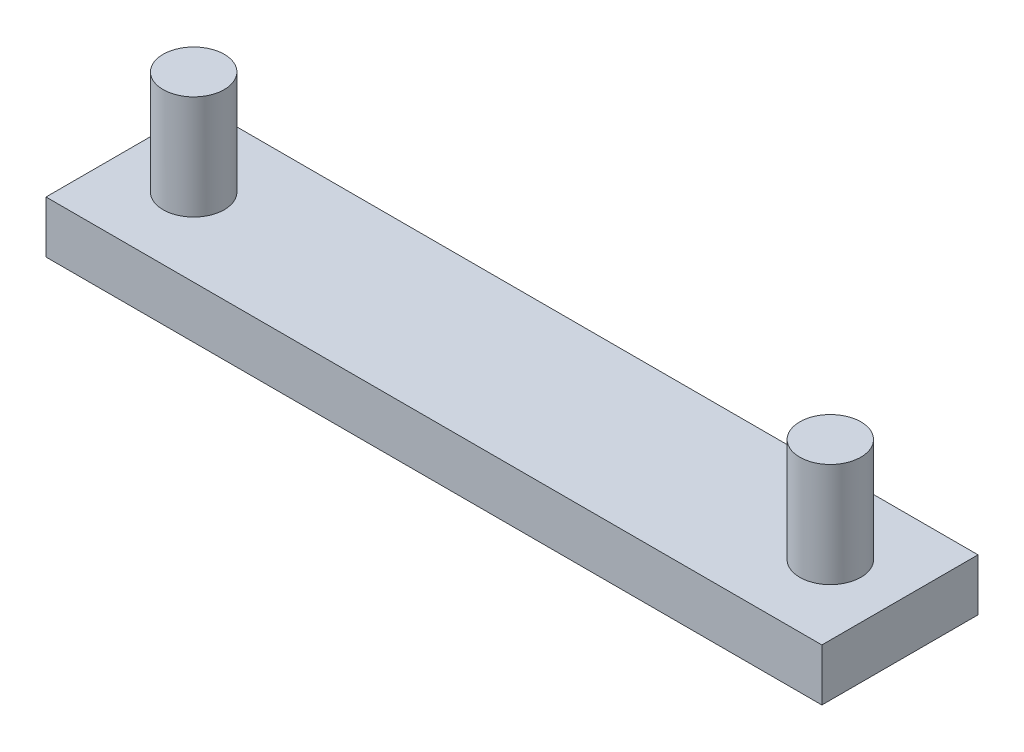
from build123d import *

# Parameters (mm, degrees)
BOSS_EXTRUDE1_DEPTH = 50.8
SKETCH2_R           = 29.86
BOSS_EXTRUDE2_DEPTH = 152.4


with BuildPart() as part:
    # Sketch1 → Boss-Extrude1 (new body)
    with BuildSketch(Plane(origin=(0, 0, 0), x_dir=(1, 0, 0), z_dir=(0, 1, 0))):
        with BuildLine():
            Line((67.96, 0), (29.86, 0))
            ThreePointArc((29.86, 0), (0, -29.86), (-29.86, 0))
            Line((-29.86, 0), (-591.61, 0))
            ThreePointArc((-591.61, 0), (-621.47, -29.86), (-651.33, 0))
            Line((-651.33, 0), (-689.43, 0))
            Line((-689.43, 0), (-689.43, -76.2))
            Line((-689.43, -76.2), (67.96, -76.2))
            Line((67.96, -76.2), (67.96, 0))
        make_face()
        with BuildLine():
            ThreePointArc((-29.86, 0), (0, 29.86), (29.86, 0))
            Line((29.86, 0), (67.96, 0))
            Line((67.96, 0), (67.96, 76.2))
            Line((67.96, 76.2), (-689.43, 76.2))
            Line((-689.43, 76.2), (-689.43, 0))
            Line((-689.43, 0), (-651.33, 0))
            ThreePointArc((-651.33, 0), (-621.47, 29.86), (-591.61, 0))
            Line((-591.61, 0), (-29.86, 0))
        make_face()
    extrude(amount=BOSS_EXTRUDE1_DEPTH)

    # Sketch2 → Boss-Extrude2 (add)
    with BuildSketch(Plane.XZ):
        with Locations(Location((0, 0, 0), (0, 0, 270))):
            Circle(SKETCH2_R)
        with Locations(Location((-621.47, 0, 0), (0, 0, 270))):
            Circle(SKETCH2_R)
    extrude(amount=-BOSS_EXTRUDE2_DEPTH)


solid = part.part
